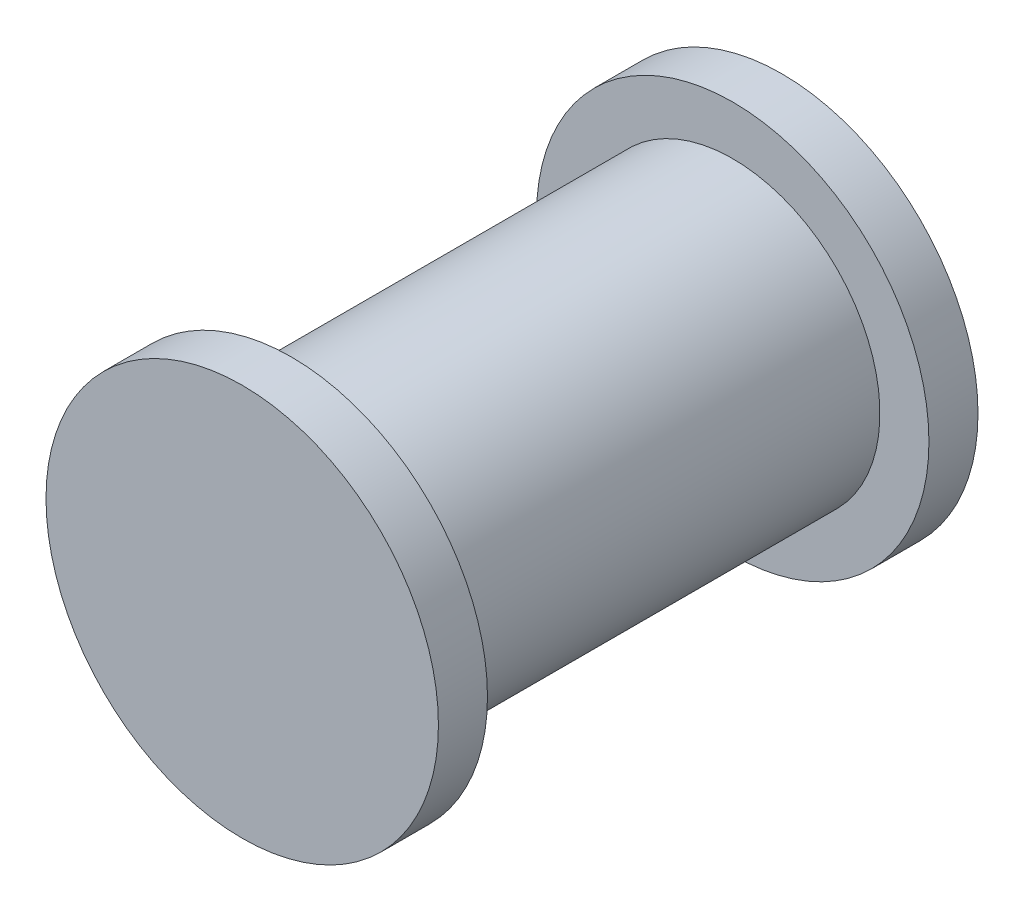
from build123d import *

# Parameters (mm, degrees)
SKETCH_1_R      = 30
EXTRUDE_1_DEPTH = 90
SKETCH_2_R      = 40
EXTRUDE_2_DEPTH = 10
EXTRUDE_START   = 10
SKETCH_3_R      = 40
EXTRUDE_3_DEPTH = 10
SCALE_1_SCALE   = 0.345


with BuildPart() as part:
    # 草图1 → 凸台-拉伸1 (new body)
    with BuildSketch(Plane.XY):
        with Locations(Location((0, 0, 0), (0, 0, 180))):
            Circle(SKETCH_1_R)
    extrude(amount=EXTRUDE_1_DEPTH)

    # 草图2 → 凸台-拉伸2 (add)
    with BuildSketch(Plane.XY.offset(90)):
        Circle(SKETCH_2_R)
    extrude(amount=EXTRUDE_2_DEPTH)

    # 草图3 → 凸台-拉伸3 (add)
    with BuildSketch(Plane(origin=(0, 0, 0), x_dir=(-1, 0, 0), z_dir=(0, 0, -1)).offset(EXTRUDE_START)):
        with Locations(Location((0, 0, 0), (0, 0, 180))):
            Circle(SKETCH_3_R)
    extrude(amount=-EXTRUDE_3_DEPTH)


with BuildPart() as part_1:
    # 缩放比例1: scaled about (0, 0, 0)
    add(part.part.scale(SCALE_1_SCALE))


solid = part_1.part
